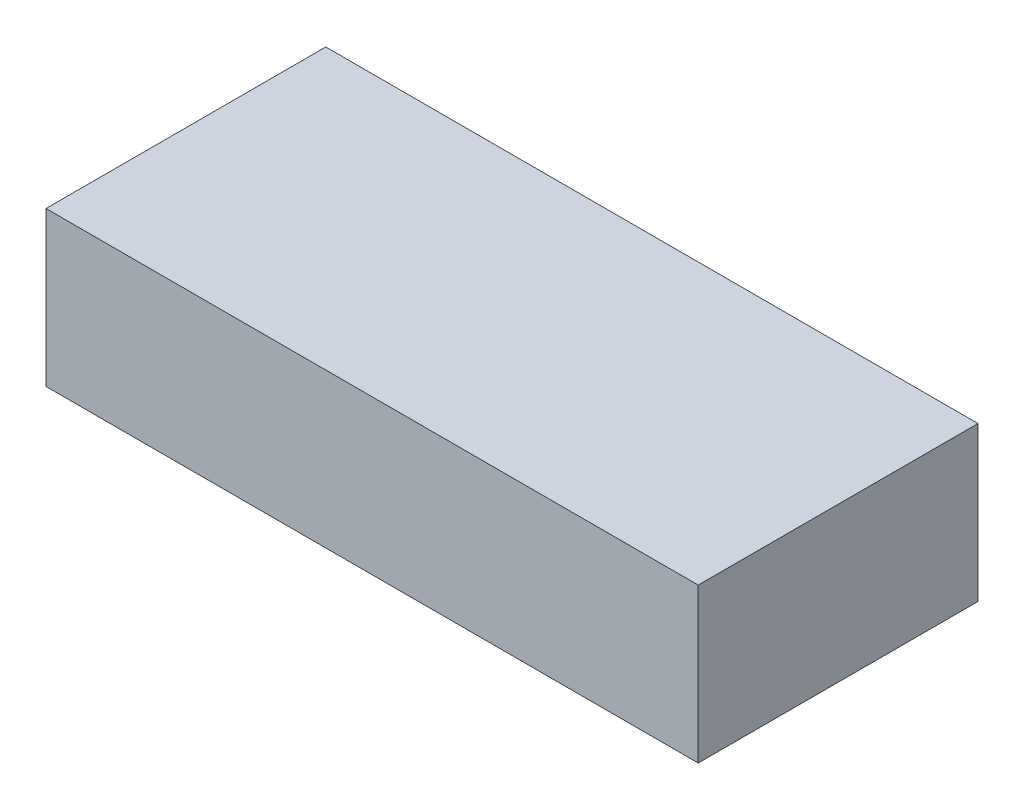
from build123d import *

# Parameters (mm, degrees)
ESQUISSE1_W        = 74.69
ESQUISSE1_H        = 32.04
BOSS_EXTRU_1_DEPTH = 17.65


with BuildPart() as part:
    # Esquisse1 → Boss.-Extru.1 (new body)
    with BuildSketch(Plane(origin=(0, 0, 0), x_dir=(1, 0, 0), z_dir=(0, 1, 0))):
        with Locations((37.345, 16.02)):
            Rectangle(ESQUISSE1_W, ESQUISSE1_H)
    extrude(amount=BOSS_EXTRU_1_DEPTH)


solid = part.part
